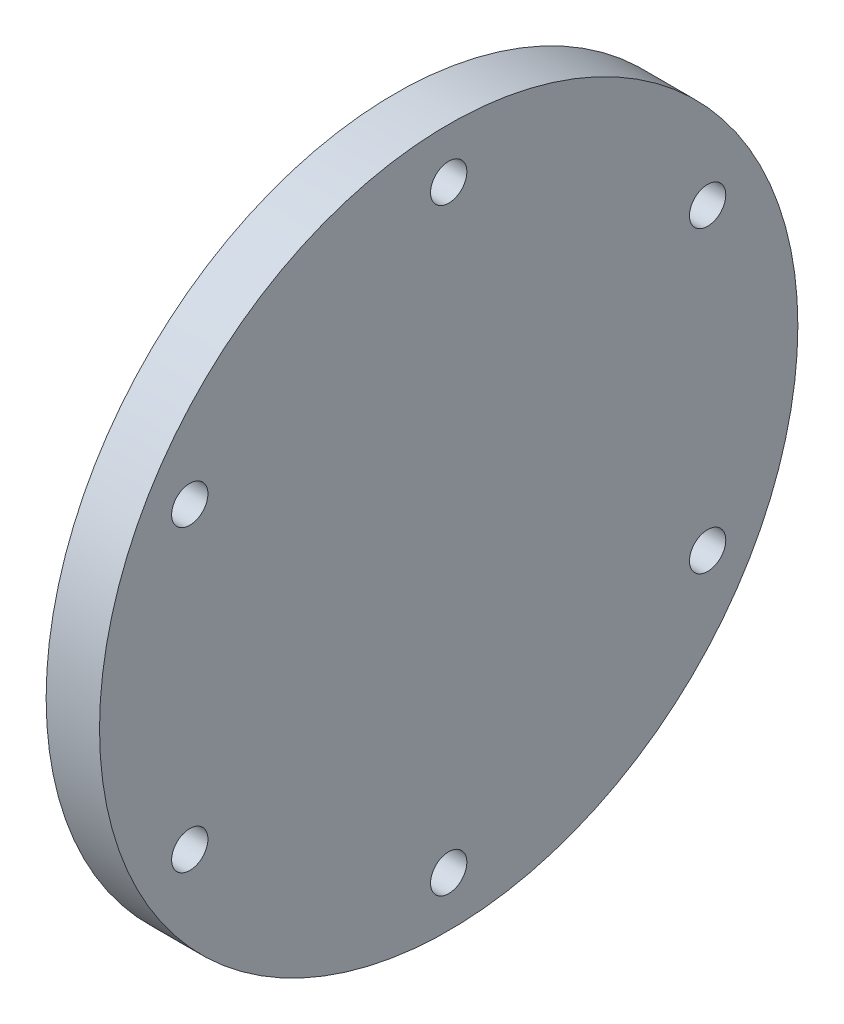
from build123d import *

# Parameters (mm, degrees)
CROQUIS1_R                       = 32.7
SALIENTE_EXTRUIR1_DEPTH          = 5
TALADRO_DE_MARGEN_PARA_M31_D     = 3.4
TALADRO_DE_MARGEN_PARA_M31_DEPTH = 10
TALADRO_DE_MARGEN_PARA_M31_TIP   = 1.021463052


with BuildPart() as part:
    # Croquis1 → Saliente-Extruir1 (new body)
    with BuildSketch(Plane(origin=(0, 0, 0), x_dir=(0, 0, -1), z_dir=(1, 0, 0))):
        Circle(CROQUIS1_R)
    extrude(amount=SALIENTE_EXTRUIR1_DEPTH)

    # Taladro de margen para M31
    with Locations(Plane(origin=(5, 0, 0), x_dir=(0, 0, -1), z_dir=(1, 0, 0))):
        with Locations((0, 28), (24.248711306, 14), (24.248711306, -14), (0, -28), (-24.248711306, -14), (-24.248711306, 14)):
            Hole(TALADRO_DE_MARGEN_PARA_M31_D / 2, depth=TALADRO_DE_MARGEN_PARA_M31_DEPTH)
            with Locations((0, 0, -(TALADRO_DE_MARGEN_PARA_M31_DEPTH + TALADRO_DE_MARGEN_PARA_M31_TIP / 2))):  # 118° drill point
                Cone(0, TALADRO_DE_MARGEN_PARA_M31_D / 2, TALADRO_DE_MARGEN_PARA_M31_TIP, mode=Mode.SUBTRACT)


solid = part.part
